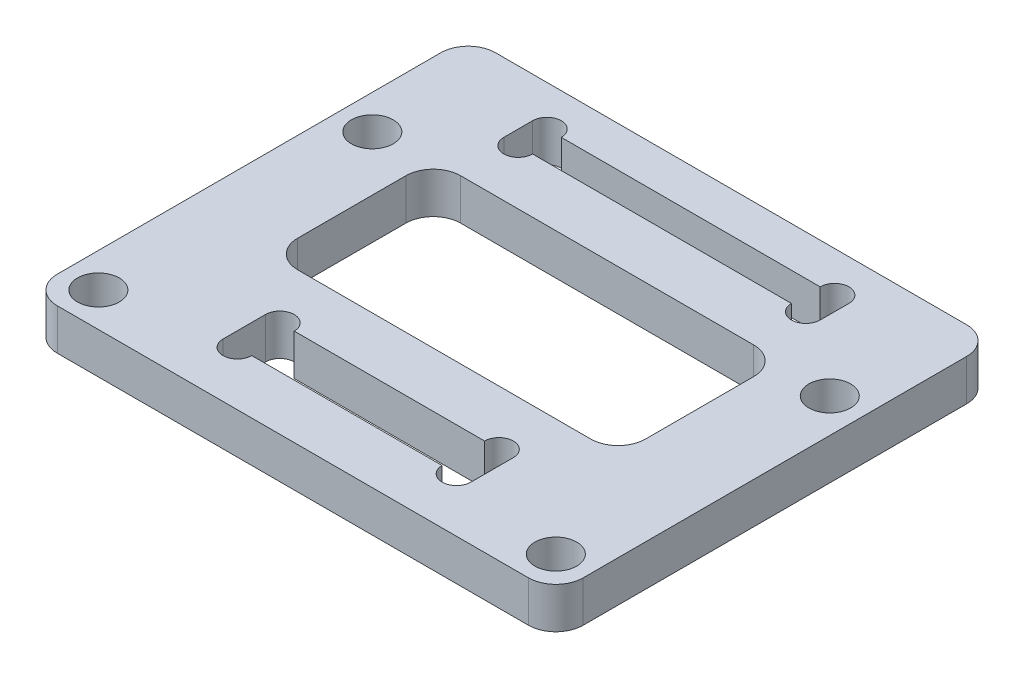
from build123d import *

# Parameters (mm, degrees)
SKETCH_1_W          = 38.4
SKETCH_1_H          = 32
EXTRUDE_1_DEPTH     = 3
SKETCH_2_R          = 1.525
CUT_EXTRUDE_1_DEPTH = 3
SKETCH_3_W          = 23.1
SKETCH_3_H          = 2.1
CUT_EXTRUDE_2_DEPTH = 3
CUT_EXTRUDE_3_DEPTH = 3
SKETCH_5_W          = 18.1
SKETCH_5_H          = 3.1
CUT_EXTRUDE_4_DEPTH = 3
SKETCH_6_R          = 1.05
CUT_EXTRUDE_5_DEPTH = 3
SKETCH_7_W          = 25.4
SKETCH_7_H          = 11.9
CUT_EXTRUDE_6_DEPTH = 3
FILLET_1_R          = 2
FILLET_2_R          = 2


with BuildPart() as part:
    # 草图1 → 凸台-拉伸1 (new body)
    with BuildSketch(Plane(origin=(0, 0, 0), x_dir=(1, 0, 0), z_dir=(0, 1, 0))):
        Rectangle(SKETCH_1_W, SKETCH_1_H)
    extrude(amount=EXTRUDE_1_DEPTH)

    # 草图2 → 切除-拉伸1 (cut)
    with BuildSketch(Plane.XZ):
        with Locations(Location((-16.7, 13.5, 0), (0, 0, 270))):
            Circle(SKETCH_2_R)
        with Locations(Location((16.7, 13.5, 0), (0, 0, 270))):
            Circle(SKETCH_2_R)
        with Locations(Location((-16.7, -6.5, 0), (0, 0, 270))):
            Circle(SKETCH_2_R)
        with Locations(Location((16.7, -6.5, 0), (0, 0, 270))):
            Circle(SKETCH_2_R)
    extrude(amount=-CUT_EXTRUDE_1_DEPTH, mode=Mode.SUBTRACT)

    # 草图3 → 切除-拉伸2 (cut)
    with BuildSketch(Plane.XZ):
        with Locations((0, -12)):
            Rectangle(SKETCH_3_W, SKETCH_3_H)
    extrude(amount=-CUT_EXTRUDE_2_DEPTH, mode=Mode.SUBTRACT)

    # 草图4 → 切除-拉伸3 (cut)
    with BuildSketch(Plane.XZ):
        with BuildLine():
            ThreePointArc((-9.45, -13.05), (-9.75753788, -12.30753788), (-10.5, -12))
            ThreePointArc((-10.5, -12), (-11.24246212, -12.30753788), (-11.55, -13.05))
            Line((-11.55, -13.05), (-9.45, -13.05))
        make_face()
        with BuildLine():
            ThreePointArc((-11.55, -13.05), (-10.5, -14.1), (-9.45, -13.05))
            Line((-9.45, -13.05), (-11.55, -13.05))
        make_face()
        with BuildLine():
            Line((-11.55, -10.95), (-9.45, -10.95))
            ThreePointArc((-9.45, -10.95), (-10.5, -9.9), (-11.55, -10.95))
        make_face()
        with BuildLine():
            ThreePointArc((-10.5, -12), (-9.75753788, -11.69246212), (-9.45, -10.95))
            Line((-9.45, -10.95), (-11.55, -10.95))
            ThreePointArc((-11.55, -10.95), (-11.24246212, -11.69246212), (-10.5, -12))
        make_face()
        with BuildLine():
            Line((9.45, -10.95), (11.55, -10.95))
            ThreePointArc((11.55, -10.95), (10.5, -9.9), (9.45, -10.95))
        make_face()
        with BuildLine():
            ThreePointArc((10.5, -12), (11.24246212, -11.69246212), (11.55, -10.95))
            Line((11.55, -10.95), (9.45, -10.95))
            ThreePointArc((9.45, -10.95), (9.75753788, -11.69246212), (10.5, -12))
        make_face()
        with BuildLine():
            ThreePointArc((11.55, -13.05), (11.24246212, -12.30753788), (10.5, -12))
            ThreePointArc((10.5, -12), (9.75753788, -12.30753788), (9.45, -13.05))
            Line((9.45, -13.05), (11.55, -13.05))
        make_face()
        with BuildLine():
            ThreePointArc((9.45, -13.05), (10.5, -14.1), (11.55, -13.05))
            Line((11.55, -13.05), (9.45, -13.05))
        make_face()
    extrude(amount=-CUT_EXTRUDE_3_DEPTH, mode=Mode.SUBTRACT)

    # 草图5 → 切除-拉伸4 (cut)
    with BuildSketch(Plane.XZ):
        with Locations((0, 10.5)):
            Rectangle(SKETCH_5_W, SKETCH_5_H)
    extrude(amount=-CUT_EXTRUDE_4_DEPTH, mode=Mode.SUBTRACT)

    # 草图6 → 切除-拉伸5 (cut)
    with BuildSketch(Plane.XZ):
        with Locations((-8, 8.95)):
            Circle(SKETCH_6_R)
        with Locations((-8, 12.05)):
            Circle(SKETCH_6_R)
        with Locations((8, 12.05)):
            Circle(SKETCH_6_R)
        with Locations((8, 8.95)):
            Circle(SKETCH_6_R)
    extrude(amount=-CUT_EXTRUDE_5_DEPTH, mode=Mode.SUBTRACT)

    # 草图7 → 切除-拉伸6 (cut)
    with BuildSketch(Plane(origin=(0, 3, 0), x_dir=(1, 0, 0), z_dir=(0, 1, 0))):
        with Locations((0, 1)):
            Rectangle(SKETCH_7_W, SKETCH_7_H)
    extrude(amount=-CUT_EXTRUDE_6_DEPTH, mode=Mode.SUBTRACT)

    # 圆角1
    fillet_1_edges = [part.edges().sort_by_distance(p)[0] for p in [
        (-12.7, 1.5, -6.95),
        (-12.7, 1.5, 4.95),
        (12.7, 1.5, 4.95),
        (12.7, 1.5, -6.95),
    ]]
    fillet(fillet_1_edges, radius=FILLET_1_R)

    # 圆角2
    fillet_2_edges = [part.edges().sort_by_distance(p)[0] for p in [
        (19.2, 1.5, 16),
        (-19.2, 1.5, 16),
        (-19.2, 1.5, -16),
        (19.2, 1.5, -16),
    ]]
    fillet(fillet_2_edges, radius=FILLET_2_R)


solid = part.part
